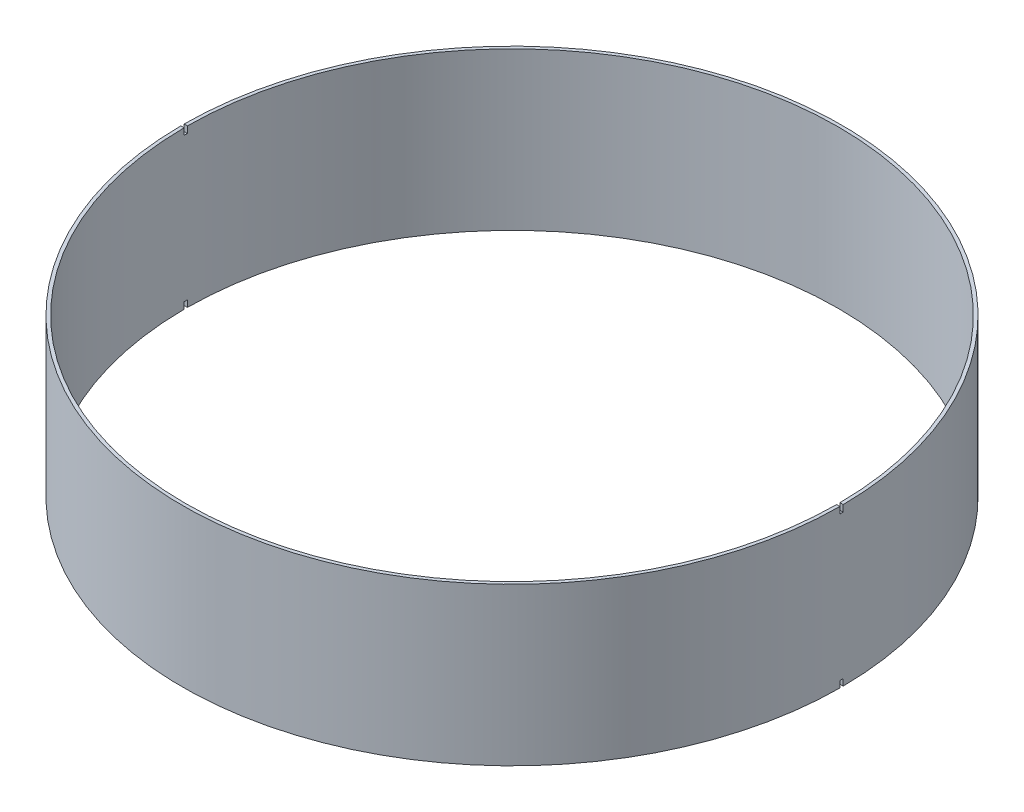
from build123d import *

# Parameters (mm, degrees)
SKETCH_1_R               = 50.3
SKETCH_1_R_2             = 49.8
EXTRUDE_1_DEPTH          = 24
CUT_EXTRUDE_2_DEPTH      = 52
CUT_EXTRUDE_2_DEPTH_BACK = 52


with BuildPart() as part:
    # Эскиз1 → Бобышка-Вытянуть1 (new body)
    with BuildSketch(Plane(origin=(0, 0, 0), x_dir=(1, 0, 0), z_dir=(0, 1, 0))):
        Circle(SKETCH_1_R)
        Circle(SKETCH_1_R_2, mode=Mode.SUBTRACT)
    extrude(amount=EXTRUDE_1_DEPTH)

    # Эскиз3 → Вырез-Вытянуть2 (cut, two sides: drawn at the far end of the back side and taken through both)
    with BuildSketch(Plane(origin=(0, 0, 0), x_dir=(0, 0, -1), z_dir=(1, 0, 0)).offset(-CUT_EXTRUDE_2_DEPTH_BACK)):
        Polygon((0, 24), (0.25, 24), (0.25, 23), (-0.25, 23), (-0.25, 24), align=None)
        Polygon((0.25, 1), (0.25, 0), (0, 0), (-0.25, 0), (-0.25, 1), align=None)
    extrude(amount=CUT_EXTRUDE_2_DEPTH + CUT_EXTRUDE_2_DEPTH_BACK, mode=Mode.SUBTRACT)


solid = part.part
